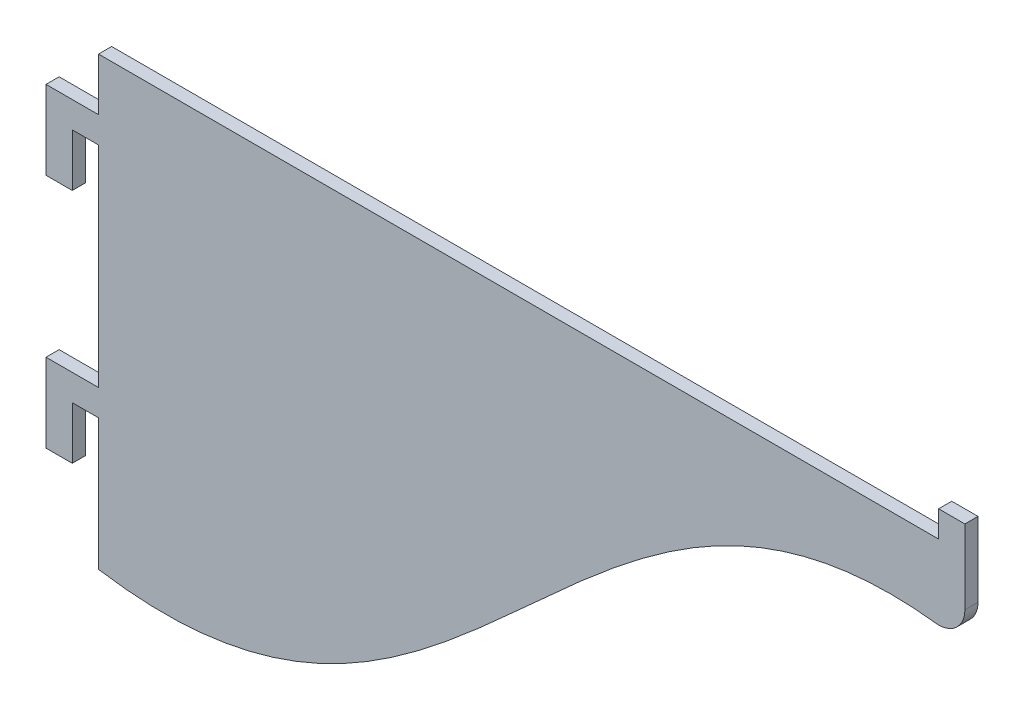
from build123d import *

# Parameters (mm, degrees)
BOSS_EXTRUDE1_DEPTH = 3.175


with BuildPart() as part:
    # Sketch1 → Boss-Extrude1 (new body)
    with BuildSketch(Plane.XY):
        with BuildLine():
            Line((0, 0), (0, -12.7))
            Line((0, -12.7), (-12.7, -12.7))
            Line((-12.7, -12.7), (-12.7, -31.75))
            Line((-12.7, -31.75), (-6.35, -31.75))
            Line((-6.35, -31.75), (-6.35, -19.05))
            Line((-6.35, -19.05), (0, -19.05))
            Line((0, -19.05), (0, -69.85))
            Line((0, -69.85), (-12.7, -69.85))
            Line((-12.7, -69.85), (-12.7, -88.9))
            Line((-12.7, -88.9), (-6.35, -88.9))
            Line((-6.35, -88.9), (-6.35, -76.2))
            Line((-6.35, -76.2), (0, -76.2))
            Line((0, -76.2), (0, -107.95))
            add(Edge.make_bspline(
                [(0, -107.95), (64.972882445, -118.248903815), (107.260828457, -42.040801067), (176.720157179, -14.882540639), (202.4483901, -17.949390151)],
                knots=[0, 0, 0, 0, 0.687412436, 0.974132151, 0.974132151, 0.974132151, 0.974132151], degree=3))
            ThreePointArc((202.4483901, -17.949390151), (207.416027581, -16.392461261), (209.55, -11.644028737))
            Line((209.55, -11.644028737), (209.55, 6.35))
            Line((209.55, 6.35), (203.2, 6.35))
            Line((203.2, 6.35), (203.2, 0))
            Line((203.2, 0), (0, 0))
        make_face()
    extrude(amount=BOSS_EXTRUDE1_DEPTH)


solid = part.part
